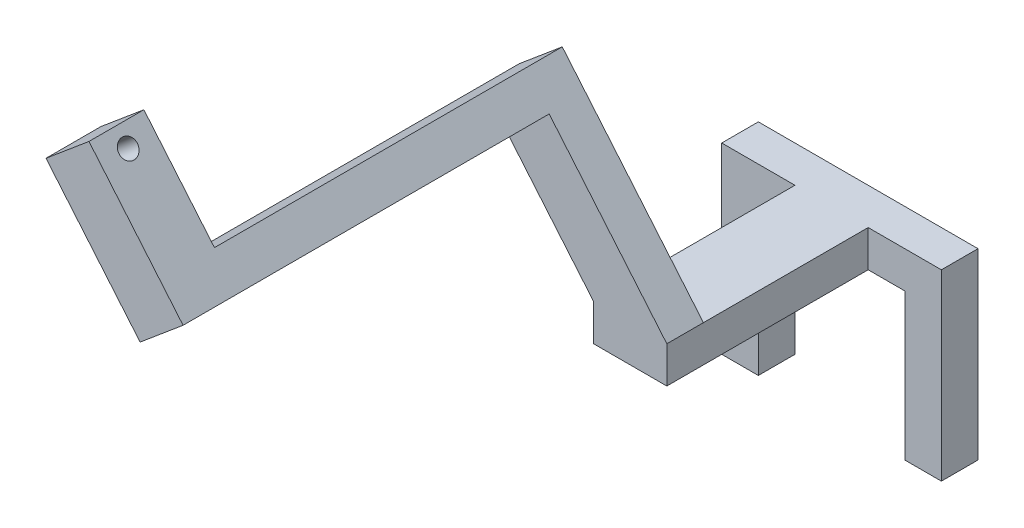
from build123d import *

# Parameters (mm, degrees)
P_IDAT_VYSUNUT_M1_DEPTH  = 10
SKICA2_W                 = 20
SKICA2_H                 = 10
P_IDAT_VYSUNUT_M2_DEPTH  = 55
P_IDAT_VYSUNUT_M3_DEPTH  = 10
SKICA4_W                 = 15.320888863
SKICA4_H                 = 110
P_IDAT_VYSUNUT_M4_DEPTH  = 10
SKICA5_W                 = 15.320888863
SKICA5_H                 = 15
P_IDAT_VYSUNUT_M5_DEPTH  = 30
SKICA6_R                 = 2.5
ODEBRAT_VYSUNUT_M1_DEPTH = 187.809937293


with BuildPart() as part:
    # Skica1 → Přidat vysunutím1 (new body)
    with BuildSketch(Plane.XY):
        Polygon((0, 0), (60, 0), (60, -50), (50, -50), (50, -10), (10, -10), (10, -50), (0, -50), align=None)
    extrude(amount=P_IDAT_VYSUNUT_M1_DEPTH)

    # Skica2 → Přidat vysunutím2 (add)
    with BuildSketch(Plane.XY.offset(10)):
        with Locations((30, -5)):
            Rectangle(SKICA2_W, SKICA2_H)
    extrude(amount=P_IDAT_VYSUNUT_M2_DEPTH)

    # Skica3 → Přidat vysunutím3 (add)
    with BuildSketch(Plane.XY.offset(65)):
        Polygon((40, 0), (7.860619516, 38.302222156), (-3.875862261, 28.454144626), (20, 0), align=None)
    extrude(amount=-P_IDAT_VYSUNUT_M3_DEPTH)

    # Skica4 → Přidat vysunutím4 (add)
    with BuildSketch(Plane(origin=(-15.612344038, 18.606067096, 0), x_dir=(0.7660444431189743, 0.6427876096865438, 0), z_dir=(-0.6427876096865438, 0.7660444431189745, 0))):
        with Locations((22.981333294, -110)):
            Rectangle(SKICA4_W, SKICA4_H)
    extrude(amount=P_IDAT_VYSUNUT_M4_DEPTH)

    # Skica5 → Přidat vysunutím5 (add)
    with BuildSketch(Plane(origin=(-22.040220135, 26.266511527, 0), x_dir=(0.7660444431189743, 0.6427876096865438, 0), z_dir=(-0.6427876096865438, 0.7660444431189745, 0))):
        with Locations((22.981333294, -157.5)):
            Rectangle(SKICA5_W, SKICA5_H)
    extrude(amount=P_IDAT_VYSUNUT_M5_DEPTH)

    # Skica6 → Odebrat vysunutím1 (cut, through all)
    with BuildSketch(Plane(origin=(23.472963553, 19.69615506, 0), x_dir=(0, 0, -1), z_dir=(0.7660444431189746, 0.6427876096865435, 0))):
        with Locations(Location((-157.5, 59.288495613, 0), (0, 0, 90))):
            Circle(SKICA6_R)
    extrude(amount=-ODEBRAT_VYSUNUT_M1_DEPTH, mode=Mode.SUBTRACT)


solid = part.part
